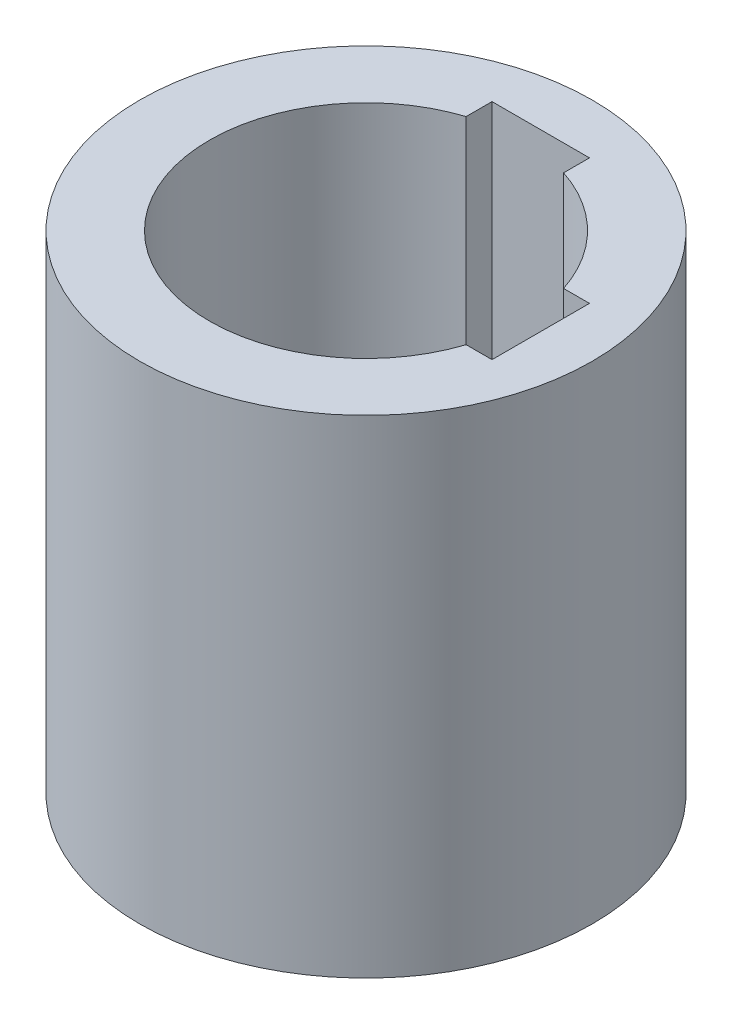
from build123d import *

# Parameters (mm, degrees)
SKETCH1_R           = 32.5
SKETCH1_R_2         = 22.5
BOSS_EXTRUDE1_DEPTH = 35
SKETCH2_W           = 7
SKETCH2_H           = 14
CUT_EXTRUDE1_DEPTH  = 84.740671122
CIRPATTERN1_COUNT   = 2
CIRPATTERN1_ANGLE   = 90


with BuildPart() as part:
    # Sketch1 → Boss-Extrude1 (new, symmetric)
    with BuildSketch(Plane(origin=(0, 0, 0), x_dir=(1, 0, 0), z_dir=(0, 1, 0))):
        with Locations(Location((0, 0, 0), (0, 0, 270))):
            Circle(SKETCH1_R)
        with Locations(Location((0, 0, 0), (0, 0, 270))):
            Circle(SKETCH1_R_2, mode=Mode.SUBTRACT)
    extrude(amount=BOSS_EXTRUDE1_DEPTH, both=True)

    # Sketch2 → Cut-Extrude1 (cut, through all)
    with BuildSketch(Plane(origin=(0, 35, 0), x_dir=(1, 0, 0), z_dir=(0, 1, 0))):
        with Locations((21.6, 0)):
            Rectangle(SKETCH2_W, SKETCH2_H)
    cut_extrude1 = extrude(amount=-CUT_EXTRUDE1_DEPTH, mode=Mode.SUBTRACT)

    # CirPattern1: Cut-Extrude1 ×2 about axis
    cirpattern1_axis = Axis((0, 0, 0), (0, 1, 0))
    for i in range(1, CIRPATTERN1_COUNT):
        add(cut_extrude1.rotate(cirpattern1_axis, i * CIRPATTERN1_ANGLE / (CIRPATTERN1_COUNT - 1)), mode=Mode.SUBTRACT)


solid = part.part
